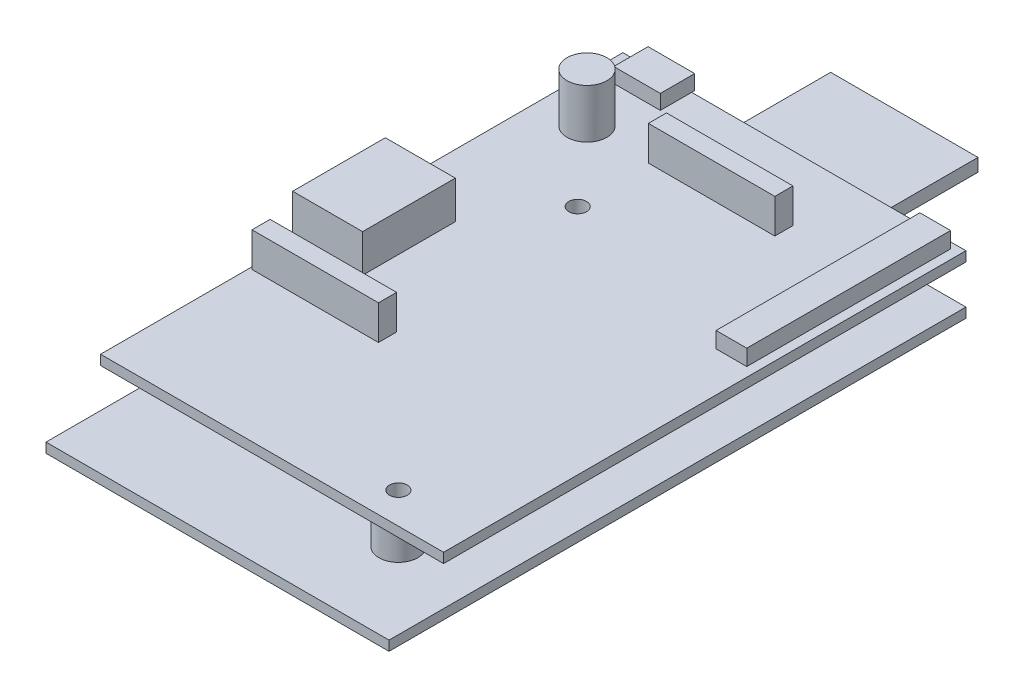
from build123d import *

# Parameters (mm, degrees)
SKETCH2_W               = 55.88
SKETCH2_H               = 85.09
FIBERGLASS_PCB_DEPTH    = 1.6
SKETCH3_W               = 7.6
SKETCH3_H               = 5.6
USB_MICRO_B_POWER_DEPTH = 2.4
SKETCH4_W               = 5
SKETCH4_H               = 33.2
BOSS_EXTRUDE3_DEPTH     = 2.6
SKETCH5_W               = 11.4
SKETCH5_H               = 15.1
BOSS_EXTRUDE4_DEPTH     = 6.15
SKETCH6_W               = 20.6
SKETCH6_H               = 2.95
BOSS_EXTRUDE5_DEPTH     = 5.6
SKETCH8_R               = 3.25
BOSS_EXTRUDE6_DEPTH     = 8
SKETCH9_W               = 28.4
SKETCH9_H               = 16.8
BOSS_EXTRUDE7_DEPTH     = 3.9
SKETCH10_W              = 24
SKETCH10_H              = 2.1
BOSS_EXTRUDE8_DEPTH     = 18
SKETCH11_R              = 1.45
CUT_EXTRUDE1_DEPTH      = 67.5955601
SKETCH12_R              = 3.175
BOSS_EXTRUDE9_DEPTH     = 6.35
SKETCH13_W              = 55.88
SKETCH13_H              = 93.98
BOSS_EXTRUDE10_DEPTH    = 1.5875
SKETCH14_R              = 1.45
CUT_EXTRUDE2_DEPTH      = 67.797698548


with BuildPart() as part:
    # Sketch2 → Fiberglass PCB (new body)
    with BuildSketch(Plane(origin=(0, 0, 0), x_dir=(1, 0, 0), z_dir=(0, 1, 0))):
        Rectangle(SKETCH2_W, SKETCH2_H)
    extrude(amount=FIBERGLASS_PCB_DEPTH)

    # Sketch3 → USB Micro-B Power (add)
    with BuildSketch(Plane(origin=(0, 1.6, 0), x_dir=(1, 0, 0), z_dir=(0, 1, 0))):
        with Locations((-20.54, 40.245)):
            Rectangle(SKETCH3_W, SKETCH3_H)
    extrude(amount=USB_MICRO_B_POWER_DEPTH)

    # Sketch4 → Boss-Extrude3 (add)
    with BuildSketch(Plane(origin=(0, 1.6, 0), x_dir=(1, 0, 0), z_dir=(0, 1, 0))):
        with Locations((23.94, 24.945)):
            Rectangle(SKETCH4_W, SKETCH4_H)
    extrude(amount=BOSS_EXTRUDE3_DEPTH)

    # Sketch5 → Boss-Extrude4 (add)
    with BuildSketch(Plane(origin=(0, 1.6, 0), x_dir=(1, 0, 0), z_dir=(0, 1, 0))):
        with Locations((-23.44, -2.505)):
            Rectangle(SKETCH5_W, SKETCH5_H)
    extrude(amount=BOSS_EXTRUDE4_DEPTH)

    # Sketch6 → Boss-Extrude5 (add)
    with BuildSketch(Plane(origin=(0, 1.6, 0), x_dir=(1, 0, 0), z_dir=(0, 1, 0))):
        with Locations((0.01, 30.52)):
            Rectangle(SKETCH6_W, SKETCH6_H)
        with Locations((-17.26, -16.78)):
            Rectangle(SKETCH6_W, SKETCH6_H)
    extrude(amount=BOSS_EXTRUDE5_DEPTH)

    # Sketch8 → Boss-Extrude6 (add)
    with BuildSketch(Plane(origin=(0, 1.6, 0), x_dir=(1, 0, 0), z_dir=(0, 1, 0))):
        with Locations(Location((-20.54, 29.295, 0), (0, 0, 90))):
            Circle(SKETCH8_R)
    extrude(amount=BOSS_EXTRUDE6_DEPTH)

    # Sketch9 → Boss-Extrude7 (add)
    with BuildSketch(Plane.XZ):
        with Locations((1.26, -32.945)):
            Rectangle(SKETCH9_W, SKETCH9_H)
    extrude(amount=BOSS_EXTRUDE7_DEPTH)

    # Sketch10 → Boss-Extrude8 (add)
    with BuildSketch(Plane(origin=(0, 0, -41.345), x_dir=(-1, 0, 0), z_dir=(0, 0, -1))):
        with Locations((-1.11, -2.1)):
            Rectangle(SKETCH10_W, SKETCH10_H)
    extrude(amount=BOSS_EXTRUDE8_DEPTH)

    # Sketch11 → Cut-Extrude1 (cut, through all)
    with BuildSketch(Plane(origin=(0, 1.6, 0), x_dir=(1, 0, 0), z_dir=(0, 1, 0))):
        with Locations(Location((15.494, -37.465, 0), (0, 0, 270))):
            Circle(SKETCH11_R)
        with Locations(Location((-9.906, 17.145, 0), (0, 0, 270))):
            Circle(SKETCH11_R)
    extrude(amount=-CUT_EXTRUDE1_DEPTH, mode=Mode.SUBTRACT)

    # Sketch12 → Boss-Extrude9 (add)
    with BuildSketch(Plane.XZ):
        with Locations(Location((-9.906, -17.145, 0), (0, 0, 270))):
            Circle(SKETCH12_R)
        with Locations(Location((15.494, 37.465, 0), (0, 0, 270))):
            Circle(SKETCH12_R)
    extrude(amount=BOSS_EXTRUDE9_DEPTH)

    # Sketch13 → Boss-Extrude10 (add)
    with BuildSketch(Plane.XZ.offset(6.35)):
        with Locations((0, 4.445)):
            Rectangle(SKETCH13_W, SKETCH13_H)
    extrude(amount=BOSS_EXTRUDE10_DEPTH)

    # Sketch14 → Cut-Extrude2 (cut, through all)
    with BuildSketch(Plane(origin=(0, 1.6, 0), x_dir=(1, 0, 0), z_dir=(0, 1, 0))):
        with Locations(Location((-9.906, 17.145, 0), (0, 0, 270))):
            Circle(SKETCH14_R)
        with Locations(Location((15.494, -37.465, 0), (0, 0, 270))):
            Circle(SKETCH14_R)
    extrude(amount=-CUT_EXTRUDE2_DEPTH, mode=Mode.SUBTRACT)


solid = part.part
